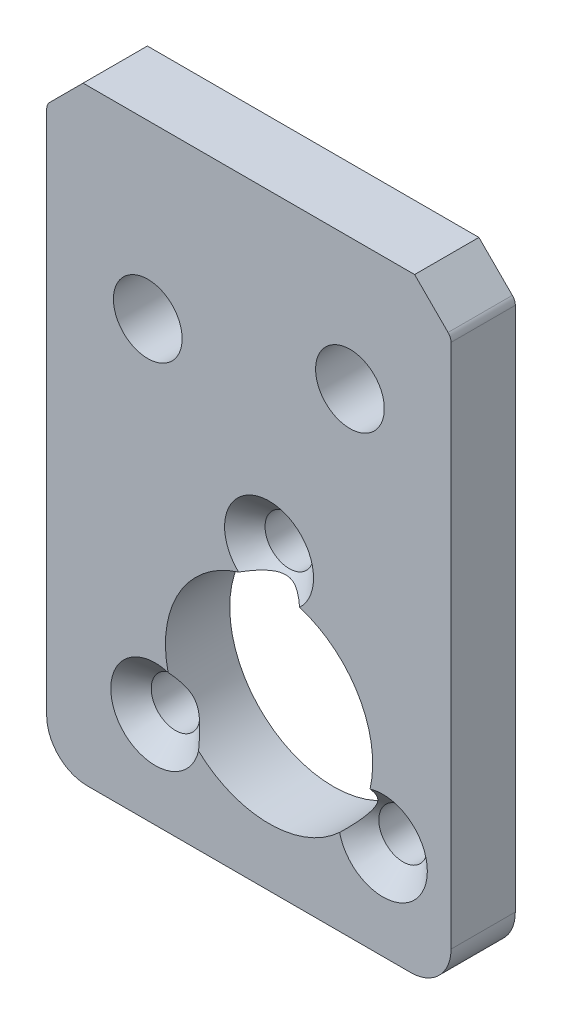
from build123d import *

# Parameters (mm, degrees)
SKETCH12_W                                      = 20
SKETCH12_H                                      = 30
SKETCH12_R                                      = 5.125
SKETCH12_R_2                                    = 1.7
BOSS_EXTRUDE3_DEPTH                             = 3.18
CSK_FOR_M2_FLAT_HEAD_MACHINE_SCREW2_D           = 2.4
CSK_FOR_M2_FLAT_HEAD_MACHINE_SCREW2_CSINK_D     = 4.4
CSK_FOR_M2_FLAT_HEAD_MACHINE_SCREW2_CSINK_ANGLE = 90
CHAMFER1_SIZE                                   = 1.8
FILLET3_R                                       = 0.5
FILLET4_R                                       = 2


with BuildPart() as part:
    # Sketch12 → Boss-Extrude3 (new body)
    with BuildSketch(Plane.XY):
        with Locations((-10, -15)):
            Rectangle(SKETCH12_W, SKETCH12_H)
        with Locations(Location((-9, -22, 0), (0, 0, 180))):
            Circle(SKETCH12_R, mode=Mode.SUBTRACT)
        with Locations(Location((-5, -6.5, 0), (0, 0, 180))):
            Circle(SKETCH12_R_2, mode=Mode.SUBTRACT)
        with Locations(Location((-15, -8.5, 0), (0, 0, 180))):
            Circle(SKETCH12_R_2, mode=Mode.SUBTRACT)
    extrude(amount=BOSS_EXTRUDE3_DEPTH)

    # CSK for M2 Flat Head Machine Screw2 (through all)
    with Locations(Plane.XY.offset(3.18)):
        with Locations((-9, -15.5), (-14.629165125, -25.25), (-3.370834875, -25.25)):
            CounterSinkHole(CSK_FOR_M2_FLAT_HEAD_MACHINE_SCREW2_D / 2, CSK_FOR_M2_FLAT_HEAD_MACHINE_SCREW2_CSINK_D / 2, counter_sink_angle=CSK_FOR_M2_FLAT_HEAD_MACHINE_SCREW2_CSINK_ANGLE)

    # Chamfer1
    chamfer1_edges = [part.edges().sort_by_distance(p)[0] for p in [
        (-20, 0, 1.59),
        (0, 0, 1.59),
    ]]
    chamfer(chamfer1_edges, length=CHAMFER1_SIZE)

    # Fillet3
    fillet3_edges = [part.edges().sort_by_distance(p)[0] for p in [
        (-20, -1.8, 1.59),
        (0, -1.8, 1.59),
    ]]
    fillet(fillet3_edges, radius=FILLET3_R)

    # Fillet4
    fillet4_edges = [part.edges().sort_by_distance(p)[0] for p in [
        (0, -30, 1.59),
        (-20, -30, 1.59),
    ]]
    fillet(fillet4_edges, radius=FILLET4_R)


solid = part.part
